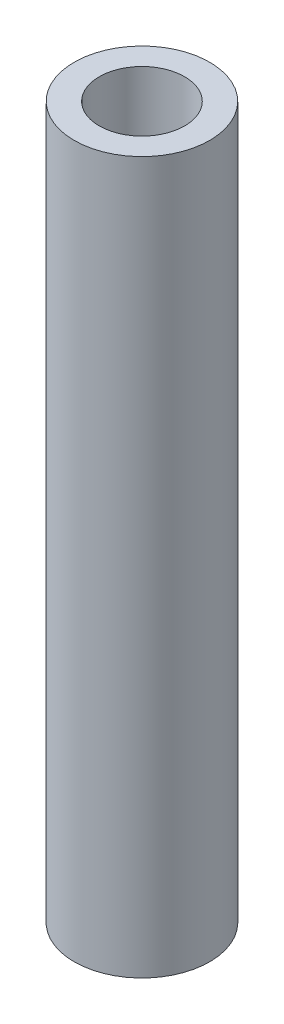
from build123d import *

# Parameters (mm, degrees)
SKETCH1_R           = 3.175
SKETCH1_R_2         = 2
BOSS_EXTRUDE1_DEPTH = 33.3375


with BuildPart() as part:
    # Sketch1 → Boss-Extrude1 (new body)
    with BuildSketch(Plane(origin=(0, 0, 0), x_dir=(1, 0, 0), z_dir=(0, 1, 0))):
        with Locations(Location((0, 0, 0), (0, 0, 270))):
            Circle(SKETCH1_R)
        with Locations(Location((0, 0, 0), (0, 0, 270))):
            Circle(SKETCH1_R_2, mode=Mode.SUBTRACT)
    extrude(amount=-BOSS_EXTRUDE1_DEPTH)


solid = part.part
